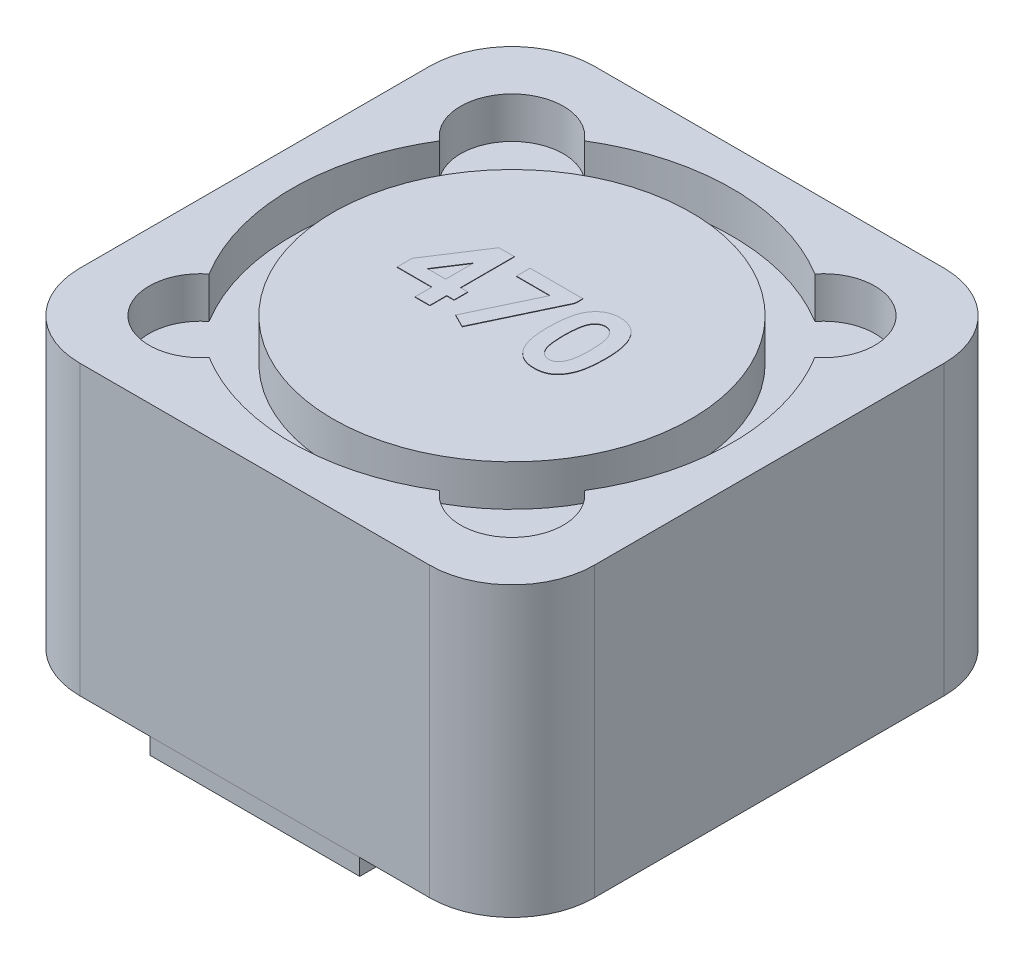
from build123d import *

# Parameters (mm, degrees)
SKETCH1_W             = 12.5
SKETCH1_H             = 12.5
BOSS_EXTRUDE1_DEPTH   = 7
SKETCH2_R             = 4.35
CUT_EXTRUDE1_DEPTH    = 1
SKETCH3_W             = 5.1
SKETCH3_H             = 0.8
BOSS_EXTRUDE2_DEPTH   = 0.4
BOSS_EXTRUDE2_2_DEPTH = 0.4
BOSS_EXTRUDE3_DEPTH   = 0.01
FILLET1_R             = 2


with BuildPart() as part:
    # Sketch1 → Boss-Extrude1 (new body)
    with BuildSketch(Plane(origin=(0, 0, 0), x_dir=(1, 0, 0), z_dir=(0, 1, 0))):
        Rectangle(SKETCH1_W, SKETCH1_H)
    extrude(amount=BOSS_EXTRUDE1_DEPTH)

    # Sketch2 → Cut-Extrude1 (cut)
    with BuildSketch(Plane(origin=(0, 7, 0), x_dir=(1, 0, 0), z_dir=(0, 1, 0))):
        with BuildLine():
            ThreePointArc((-4.557595229, 2.801932498), (-5.35, 0), (-4.557595229, -2.801932498))
            ThreePointArc((-4.557595229, -2.801932498), (-4.666904756, -4.666904756), (-2.801932498, -4.557595229))
            ThreePointArc((-2.801932498, -4.557595229), (0, -5.35), (2.801932498, -4.557595229))
            ThreePointArc((2.801932498, -4.557595229), (4.666904756, -4.666904756), (4.557595229, -2.801932498))
            ThreePointArc((4.557595229, -2.801932498), (5.35, 0), (4.557595229, 2.801932498))
            ThreePointArc((4.557595229, 2.801932498), (4.666904756, 4.666904756), (2.801932498, 4.557595229))
            ThreePointArc((2.801932498, 4.557595229), (0, 5.35), (-2.801932498, 4.557595229))
            ThreePointArc((-2.801932498, 4.557595229), (-4.666904756, 4.666904756), (-4.557595229, 2.801932498))
        make_face()
        with Locations(Location((0, 0, 0), (0, 0, 270))):
            Circle(SKETCH2_R, mode=Mode.SUBTRACT)
    extrude(amount=-CUT_EXTRUDE1_DEPTH, mode=Mode.SUBTRACT)

    # Sketch4 → Boss-Extrude3 (add)
    # profile 1 of 3: a face of its own
    with BuildSketch(Plane(origin=(0, 7, 0), x_dir=(1, 0, 0), z_dir=(0, 1, 0))):
        Polygon((-1.580043076, 1.261031415), (-1.205844358, 1.261031415), (-1.205844358, -0.046660893), (-1.026357178, -0.046660893), (-1.026357178, -0.379994226), (-1.205844358, -0.379994226), (-1.205844358, -0.790250636), (-1.564818717, -0.790250636), (-1.564818717, -0.379994226), (-2.410972563, -0.379994226), (-2.410972563, -0.016612816), align=None)
        Polygon((-1.564818717, -0.046660893), (-1.564818717, 0.63402821), (-2.00752705, -0.046660893), align=None, mode=Mode.SUBTRACT)
    # profile 2 of 3: a face of its own
    with BuildSketch(Plane(origin=(0, 7, 0), x_dir=(1, 0, 0), z_dir=(0, 1, 0))):
        Polygon((-0.769946922, 1.209749364), (0.51210436, 1.209749364), (0.51210436, 1.023451287), (-0.370107178, -0.841532688), (-0.688216153, -0.681276277), (0.048963335, 0.87641603), (-0.769946922, 0.87641603), align=None)
    # profile 3 of 3: a face of its own
    with BuildSketch(Plane(origin=(0, 7, 0), x_dir=(1, 0, 0), z_dir=(0, 1, 0))):
        with BuildLine():
            add(Edge.make_bspline(
                [(1.365069104, 1.261031415), (1.382444953, 1.260773466), (1.416610514, 1.260266268), (1.466929955, 1.254772907), (1.515401489, 1.246473971), (1.562214743, 1.234899849), (1.60703275, 1.219581911), (1.650181705, 1.201246601), (1.69114801, 1.178932195), (1.730454117, 1.153726928), (1.768084886, 1.125190993), (1.803135886, 1.092658553), (1.836247224, 1.056878181), (1.866702161, 1.017308943), (1.895175131, 0.974310762), (1.921572577, 0.927876821), (1.945692419, 0.877779856), (1.967804983, 0.823929463), (1.987578108, 0.765518449), (2.004232987, 0.701876813), (2.018517333, 0.632990023), (2.030574328, 0.558686607), (2.039687468, 0.4788678), (2.045829907, 0.393586629), (2.05004514, 0.303007503), (2.050389158, 0.240870967), (2.050565899, 0.208948082)],
                knots=[0, 0, 0, 0, 0.879237366, 1.728815576, 2.559023295, 3.367336655, 4.166867292, 4.954216142, 5.737608147, 6.525189134, 7.316157332, 8.124696809, 8.942788509, 9.781158001, 10.649253743, 11.551476218, 12.482711956, 13.461909668, 14.496590415, 15.601789533, 16.789733467, 18.056700938, 19.410929216, 20.8549011, 22.384193279, 24, 24, 24, 24], degree=3))
            add(Edge.make_bspline(
                [(2.050565899, 0.208948082), (2.05037489, 0.176625805), (2.050003763, 0.113824201), (2.046005136, 0.022416592), (2.03911931, -0.063483771), (2.030244362, -0.143868003), (2.018088109, -0.218693654), (2.003851448, -0.288154471), (1.986933677, -0.352225278), (1.966509232, -0.410761708), (1.944530515, -0.464706674), (1.920344695, -0.514705961), (1.894373327, -0.560894997), (1.867212115, -0.603970605), (1.837371983, -0.642662938), (1.806305333, -0.678287739), (1.772659469, -0.709488012), (1.737851011, -0.737871679), (1.700604784, -0.762400864), (1.6613049, -0.783853685), (1.619250709, -0.80125447), (1.575208788, -0.816388744), (1.528428433, -0.827253519), (1.479652978, -0.835874362), (1.428331758, -0.840638768), (1.393390204, -0.841229824), (1.37548577, -0.841532688)],
                knots=[0, 0, 0, 0, 1.643780988, 3.193836972, 4.651895693, 6.025988579, 7.305620092, 8.505800249, 9.631074763, 10.672816429, 11.65661981, 12.592235626, 13.49536222, 14.350718032, 15.179365177, 15.97804903, 16.751647189, 17.51006938, 18.259804725, 19.016521909, 19.783502495, 20.571750527, 21.382245291, 22.22305063, 23.089471752, 24, 24, 24, 24], degree=3))
            add(Edge.make_bspline(
                [(1.37548577, -0.841532688), (1.35758182, -0.841223982), (1.322508245, -0.840619232), (1.271048247, -0.835909787), (1.222014307, -0.827218596), (1.174863844, -0.816305332), (1.129925019, -0.801287956), (1.086982352, -0.783366552), (1.046366033, -0.762047586), (1.007963604, -0.73746125), (0.971906181, -0.709267491), (0.937633432, -0.677767872), (0.905221169, -0.643042236), (0.875162465, -0.604701628), (0.846965044, -0.563257814), (0.820922961, -0.518237527), (0.797051866, -0.469706315), (0.774605068, -0.417596531), (0.755101642, -0.36078631), (0.737744498, -0.298768345), (0.723525982, -0.231025665), (0.7120905, -0.157580032), (0.702960418, -0.078587045), (0.696168686, 0.005991424), (0.692147848, 0.09619477), (0.691780614, 0.158196023), (0.69159154, 0.190117953)],
                knots=[0, 0, 0, 0, 0.917216111, 1.796812873, 2.643793957, 3.46689424, 4.273913431, 5.068098542, 5.848489301, 6.620921603, 7.401012384, 8.190319798, 9.003608147, 9.831726257, 10.68377682, 11.569763213, 12.493818149, 13.453288342, 14.474581811, 15.568529029, 16.750744269, 18.018426408, 19.375425659, 20.823733699, 22.36466933, 24, 24, 24, 24], degree=3))
            add(Edge.make_bspline(
                [(0.69159154, 0.190117953), (0.69193403, 0.234470962), (0.692594869, 0.320050664), (0.700969509, 0.443688451), (0.713261357, 0.557970167), (0.73131517, 0.662704649), (0.753638459, 0.758279801), (0.782224594, 0.844066025), (0.814767829, 0.921250365), (0.842498846, 0.966974833), (0.85585436, 0.988996159)],
                knots=[0, 0, 0, 0, 1.288568992, 2.486310467, 3.599230591, 4.627010532, 5.572937695, 6.447898582, 7.252493626, 8, 8, 8, 8], degree=3))
            add(Edge.make_bspline(
                [(0.85585436, 0.988996159), (0.871383516, 1.010629902), (0.901746074, 1.052928134), (0.954835857, 1.108457806), (1.011873916, 1.1559495), (1.074031782, 1.194328438), (1.1403264, 1.224594071), (1.211326945, 1.245970347), (1.286771223, 1.258425162), (1.338580067, 1.260149691), (1.365069104, 1.261031415)],
                knots=[0, 0, 0, 0, 1.058512271, 2.069600068, 3.047294572, 4.004278952, 4.967380941, 5.939006123, 6.946246673, 8, 8, 8, 8], degree=3))
        make_face()
        with BuildLine():
            add(Edge.make_bspline(
                [(1.373883206, 0.902057056), (1.358175295, 0.901312532), (1.32737945, 0.89985287), (1.282693212, 0.887462401), (1.24055688, 0.868324653), (1.208504897, 0.845295365), (1.184514307, 0.823219031), (1.167751909, 0.803240667), (1.151587219, 0.780946252), (1.13730975, 0.755329755), (1.123828093, 0.727311606), (1.11065245, 0.69676462), (1.099851883, 0.662938496), (1.089240611, 0.626409298), (1.079944148, 0.586167091), (1.072155749, 0.541882939), (1.0651975, 0.493268857), (1.060344038, 0.440293005), (1.055819155, 0.383010807), (1.052575504, 0.321294661), (1.051219416, 0.255161217), (1.050788356, 0.209616096), (1.050565899, 0.186111543)],
                knots=[0, 0, 0, 0, 1.076674018, 2.110852608, 3.161083442, 4.239746716, 4.804137807, 5.395870207, 6.026861976, 6.692161227, 7.405688833, 8.16177676, 8.973626916, 9.841385931, 10.773283133, 11.807421078, 12.927755683, 14.143907515, 15.458935494, 16.872852025, 18.386167141, 20, 20, 20, 20], degree=3))
            add(Edge.make_bspline(
                [(1.050565899, 0.186111543), (1.050932037, 0.155660259), (1.051634134, 0.097267664), (1.055311391, 0.01329708), (1.062682146, -0.063122914), (1.071849878, -0.132510242), (1.084726332, -0.194414911), (1.099541526, -0.249422596), (1.117836973, -0.296832082), (1.138980887, -0.337329017), (1.162398725, -0.371779676), (1.187819818, -0.40106289), (1.214378669, -0.426420773), (1.242904267, -0.447018668), (1.273328557, -0.462803946), (1.305397553, -0.474158101), (1.339131634, -0.481108452), (1.362232385, -0.482072243), (1.373883206, -0.482558329)],
                knots=[0, 0, 0, 0, 1.771748488, 3.397459088, 4.888034009, 6.237357457, 7.467047327, 8.564189669, 9.548206622, 10.417051504, 11.216568818, 11.965764335, 12.669334354, 13.348544111, 14.005342236, 14.656555988, 15.322436492, 16, 16, 16, 16], degree=3))
            add(Edge.make_bspline(
                [(1.373883206, -0.482558329), (1.385134208, -0.482225713), (1.407162271, -0.481574492), (1.43928412, -0.474889797), (1.469660823, -0.464021935), (1.498200663, -0.448648582), (1.525005723, -0.429099011), (1.549944996, -0.405287313), (1.572830397, -0.376976142), (1.586163535, -0.355965065), (1.593033847, -0.345138457)],
                knots=[0, 0, 0, 0, 0.992283464, 1.942767638, 2.88273346, 3.832339453, 4.79467288, 5.803907806, 6.868395428, 8, 8, 8, 8], degree=3))
            add(Edge.make_bspline(
                [(1.593033847, -0.345138457), (1.601122483, -0.330344242), (1.618083697, -0.299321975), (1.637711243, -0.246973055), (1.654232618, -0.187932125), (1.668452323, -0.122015445), (1.678177734, -0.048963031), (1.686553246, 0.030761886), (1.690592963, 0.117560768), (1.691250045, 0.177695347), (1.69159154, 0.208948082)],
                knots=[0, 0, 0, 0, 0.710965849, 1.490837728, 2.352621235, 3.297892224, 4.334225155, 5.461620853, 6.680770821, 8, 8, 8, 8], degree=3))
            add(Edge.make_bspline(
                [(1.69159154, 0.208948082), (1.691459628, 0.240472105), (1.69120572, 0.30115047), (1.686547248, 0.3882614), (1.680059969, 0.467822777), (1.670570952, 0.539656973), (1.658361608, 0.60393837), (1.643313545, 0.660662766), (1.625572998, 0.709941954), (1.604534824, 0.751726795), (1.581233739, 0.787238178), (1.556498926, 0.817704191), (1.530225796, 0.843715303), (1.502458286, 0.865369401), (1.472553708, 0.881914755), (1.441083278, 0.893597144), (1.40798248, 0.900664598), (1.385403049, 0.901586638), (1.373883206, 0.902057056)],
                knots=[0, 0, 0, 0, 1.793836731, 3.452829483, 4.963243077, 6.335886805, 7.574563692, 8.684454726, 9.672768357, 10.54971625, 11.340229787, 12.085688095, 12.778991901, 13.440269426, 14.083255152, 14.715733572, 15.344777694, 16, 16, 16, 16], degree=3))
        make_face(mode=Mode.SUBTRACT)
    extrude(amount=BOSS_EXTRUDE3_DEPTH)

    # Fillet1
    fillet1_edges = [part.edges().sort_by_distance(p)[0] for p in [
        (6.25, 3.5, 6.25),
        (-6.25, 3.5, 6.25),
        (-6.25, 3.5, -6.25),
        (6.25, 3.5, -6.25),
    ]]
    fillet(fillet1_edges, radius=FILLET1_R)


with BuildPart() as body_2:
    # Sketch3 → Boss-Extrude2 (new body)
    with BuildSketch(Plane.XZ):
        with Locations((0, 5.85)):
            Rectangle(SKETCH3_W, SKETCH3_H)
    extrude(amount=BOSS_EXTRUDE2_DEPTH)


with BuildPart() as body_3:
    # Sketch3 → Boss-Extrude2 2 (new body)
    with BuildSketch(Plane.XZ):
        with Locations((0, -5.85)):
            Rectangle(SKETCH3_W, SKETCH3_H)
    extrude(amount=BOSS_EXTRUDE2_2_DEPTH)


solid = Compound([part.part, body_2.part, body_3.part])
